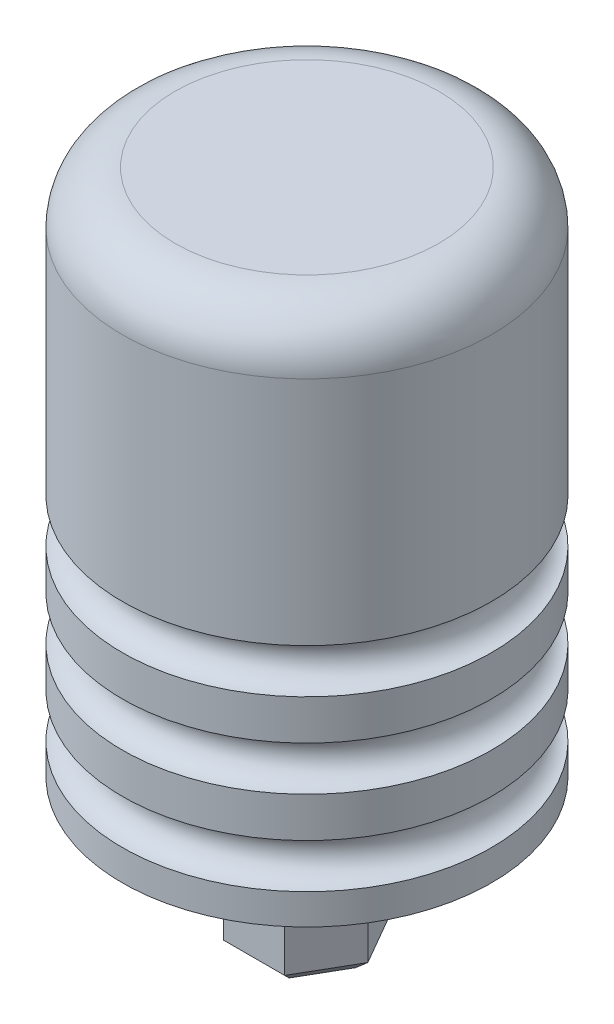
from build123d import *

# Parameters (mm, degrees)
BOSS_EXTRUDE1_DEPTH = 17.018
FILLET1_R           = 3.81
CHAMFER1_SIZE       = 1.27


with BuildPart() as part:
    # Sketch1 → Revolve1 (revolve)
    with BuildSketch(Plane.XY, mode=Mode.PRIVATE) as revolve1_sk:
        with BuildLine():
            Line((0, 0), (0, 63.5))
            Line((0, 63.5), (15.875, 63.5))
            ThreePointArc((15.875, 63.5), (20.365128061, 61.640128061), (22.225, 57.15))
            Line((22.225, 57.15), (22.225, 29.337))
            ThreePointArc((22.225, 29.337), (19.558, 26.67), (22.225, 24.003))
            Line((22.225, 24.003), (22.225, 19.177))
            ThreePointArc((22.225, 19.177), (19.558, 16.51), (22.225, 13.843))
            Line((22.225, 13.843), (22.225, 9.017))
            ThreePointArc((22.225, 9.017), (19.558, 6.35), (22.225, 3.683))
            Line((22.225, 3.683), (22.225, 0))
            Line((22.225, 0), (0, 0))
        make_face()
    revolve(revolve1_sk.sketch.rotate(Axis((0, 0, 0), (0, 1, 0)), 90), axis=Axis((0, 0, 0), (0, 1, 0)))

    # Sketch2 → Boss-Extrude1 (add)
    with BuildSketch(Plane(origin=(0, 0, 0), x_dir=(-1, 0, 0), z_dir=(0, -1, 0))):
        Polygon((-7.332348419, 0), (-3.666174209, -6.35), (3.666174209, -6.35), (7.332348419, 0), (3.666174209, 6.35), (-3.666174209, 6.35), align=None)
    extrude(amount=BOSS_EXTRUDE1_DEPTH)

    # Fillet1
    fillet1_edges = [part.edges().sort_by_distance(p)[0] for p in [
        (5.499261314, 0, -3.175),
        (5.499261314, 0, 3.175),
        (0, 0, 6.35),
        (-5.499261314, 0, 3.175),
        (-5.499261314, 0, -3.175),
        (0, 0, -6.35),
    ]]
    fillet(fillet1_edges, radius=FILLET1_R)

    # Chamfer1
    chamfer1_edges = [part.edges().sort_by_distance(p)[0] for p in [
        (5.499261314, -17.018, -3.175),
        (5.499261314, -17.018, 3.175),
        (0, -17.018, 6.35),
        (-5.499261314, -17.018, 3.175),
        (-5.499261314, -17.018, -3.175),
        (0, -17.018, -6.35),
    ]]
    chamfer(chamfer1_edges, length=CHAMFER1_SIZE)


solid = part.part
